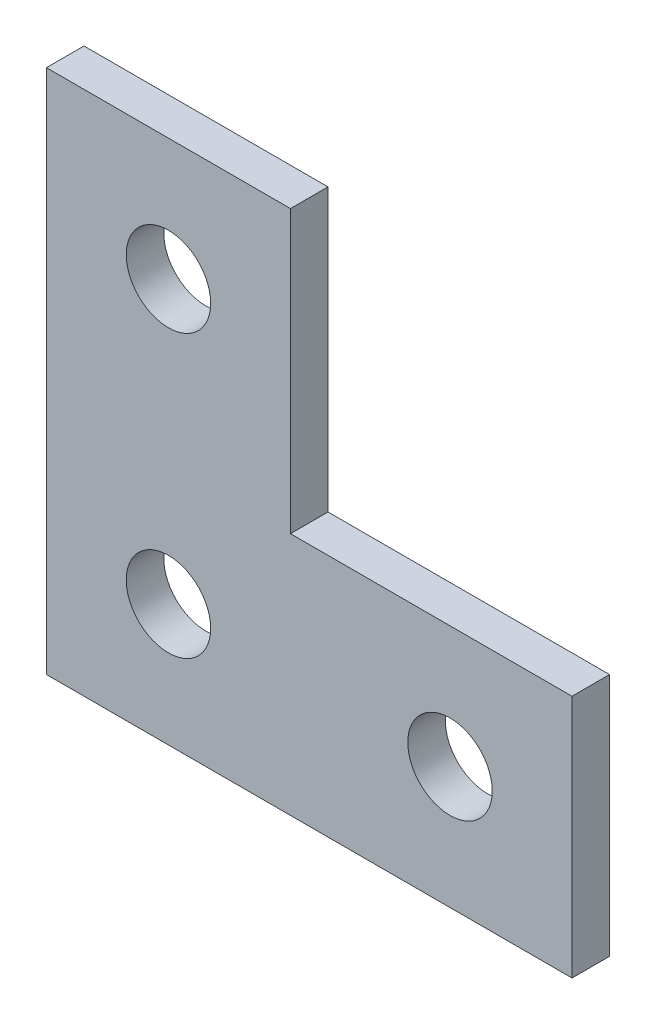
from build123d import *

# Parameters (mm, degrees)
SKETCH1_R           = 7.14375
BOSS_EXTRUDE1_DEPTH = 3.175


with BuildPart() as part:
    # Sketch1 → Boss-Extrude1 (new, symmetric)
    with BuildSketch(Plane.XY):
        Polygon((0, 88.9), (0, 0), (88.9, 0), (88.9, 41.275), (41.275, 41.275), (41.275, 88.9), align=None)
        with Locations((20.6375, 20.6375)):
            Circle(SKETCH1_R, mode=Mode.SUBTRACT)
        with Locations((20.6375, 68.2625)):
            Circle(SKETCH1_R, mode=Mode.SUBTRACT)
        with Locations((68.2625, 20.6375)):
            Circle(SKETCH1_R, mode=Mode.SUBTRACT)
    extrude(amount=BOSS_EXTRUDE1_DEPTH, both=True)


solid = part.part
